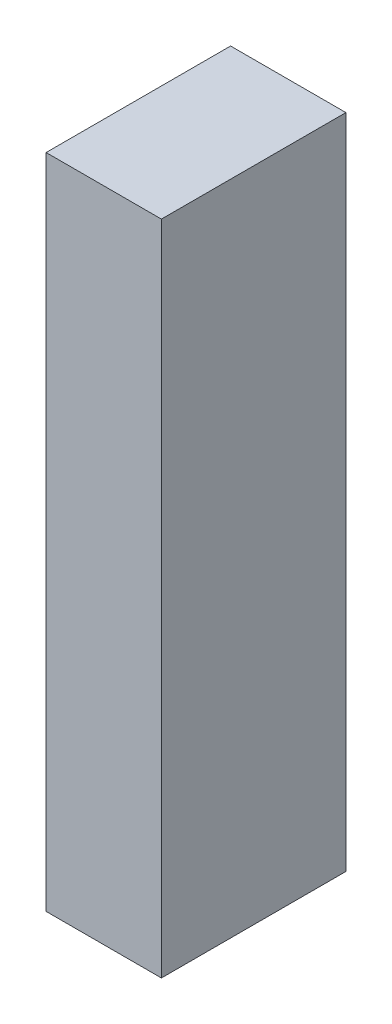
from build123d import *

# Parameters (mm, degrees)
OVEN_FIRIN_BUHAR_KANALI_1_START = -600
SKETCH1_W                       = 100
SKETCH1_H                       = 570
OVEN_FIRIN_BUHAR_KANALI_1_DEPTH = 160


with BuildPart() as part:
    # Sketch1 → OVEN_firin_buhar_kanali_1 (new body)
    with BuildSketch(Plane.XY.offset(OVEN_FIRIN_BUHAR_KANALI_1_START)):
        with Locations((350, 1405)):
            Rectangle(SKETCH1_W, SKETCH1_H)
    extrude(amount=-OVEN_FIRIN_BUHAR_KANALI_1_DEPTH)


solid = part.part
